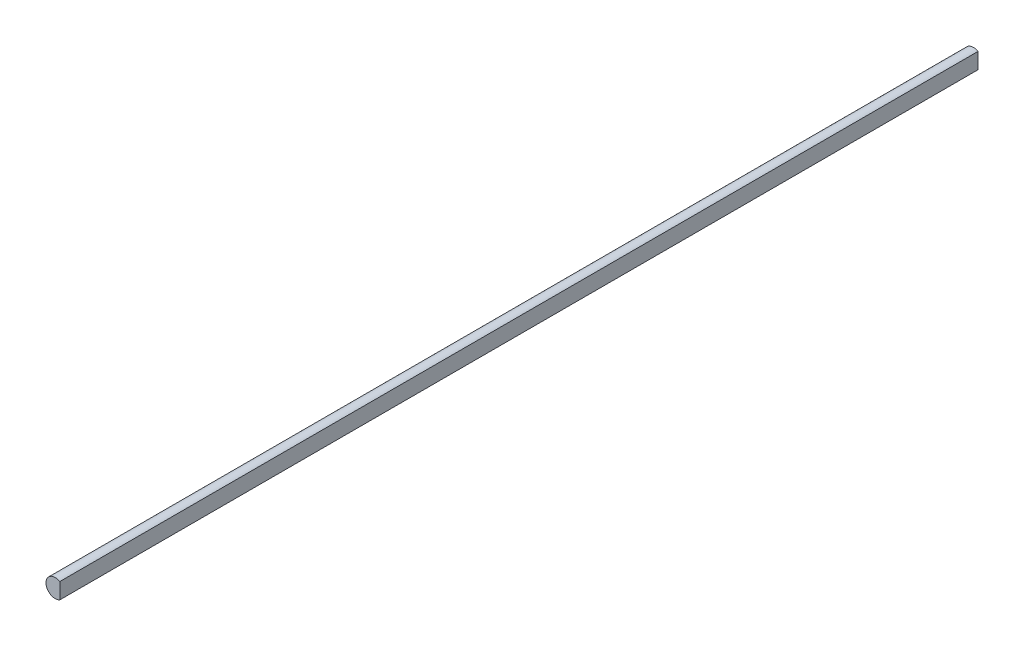
from build123d import *

# Parameters (mm, degrees)
BOSS_EXTRUDE1_DEPTH = 150


with BuildPart() as part:
    # Sketch1 → Boss-Extrude1 (new body)
    with BuildSketch(Plane.XY):
        with BuildLine():
            Line((0.75, 1.299038106), (0.75, -1.299038106))
            ThreePointArc((0.75, -1.299038106), (-1.5, 0), (0.75, 1.299038106))
        make_face()
    extrude(amount=BOSS_EXTRUDE1_DEPTH)


solid = part.part
